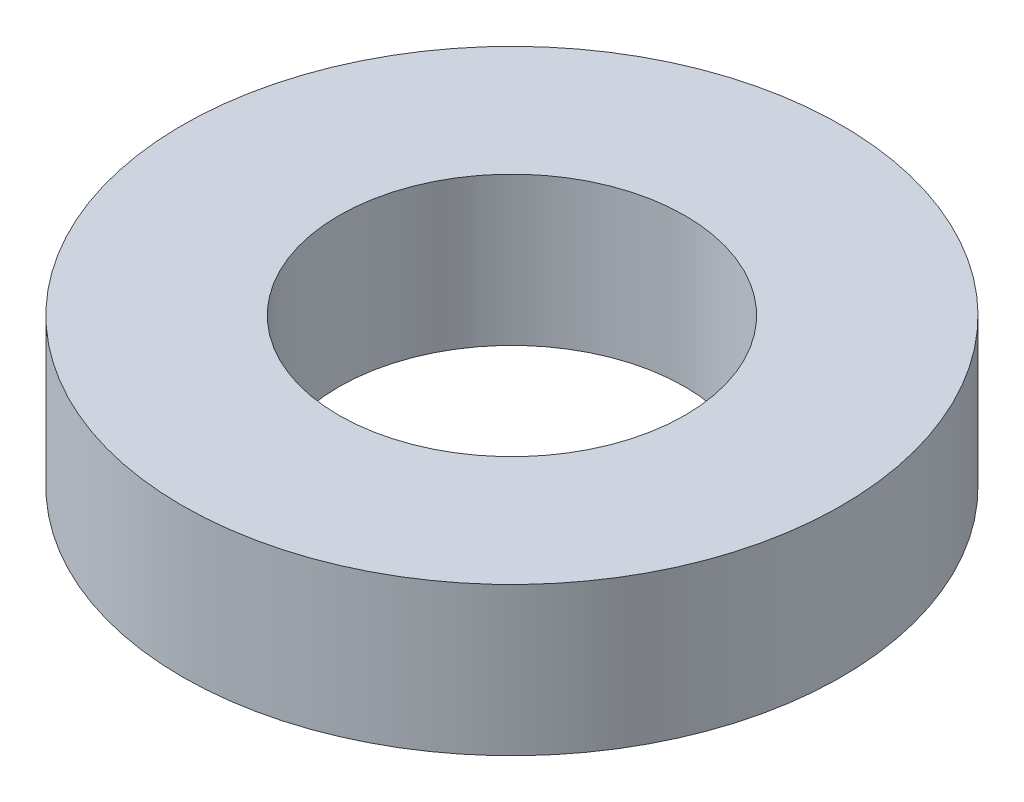
from build123d import *

# Parameters (mm, degrees)
SKETCH_1_R      = 4
SKETCH_1_R_2    = 2.1
EXTRUDE_1_DEPTH = 1.8


with BuildPart() as part:
    # 草图1 → 凸台-拉伸1 (new body)
    with BuildSketch(Plane(origin=(0, 0, 0), x_dir=(1, 0, 0), z_dir=(0, 1, 0))):
        with Locations(Location((0, 0, 0), (0, 0, 270))):
            Circle(SKETCH_1_R)
        with Locations(Location((0, 0, 0), (0, 0, 270))):
            Circle(SKETCH_1_R_2, mode=Mode.SUBTRACT)
    extrude(amount=EXTRUDE_1_DEPTH)


solid = part.part
